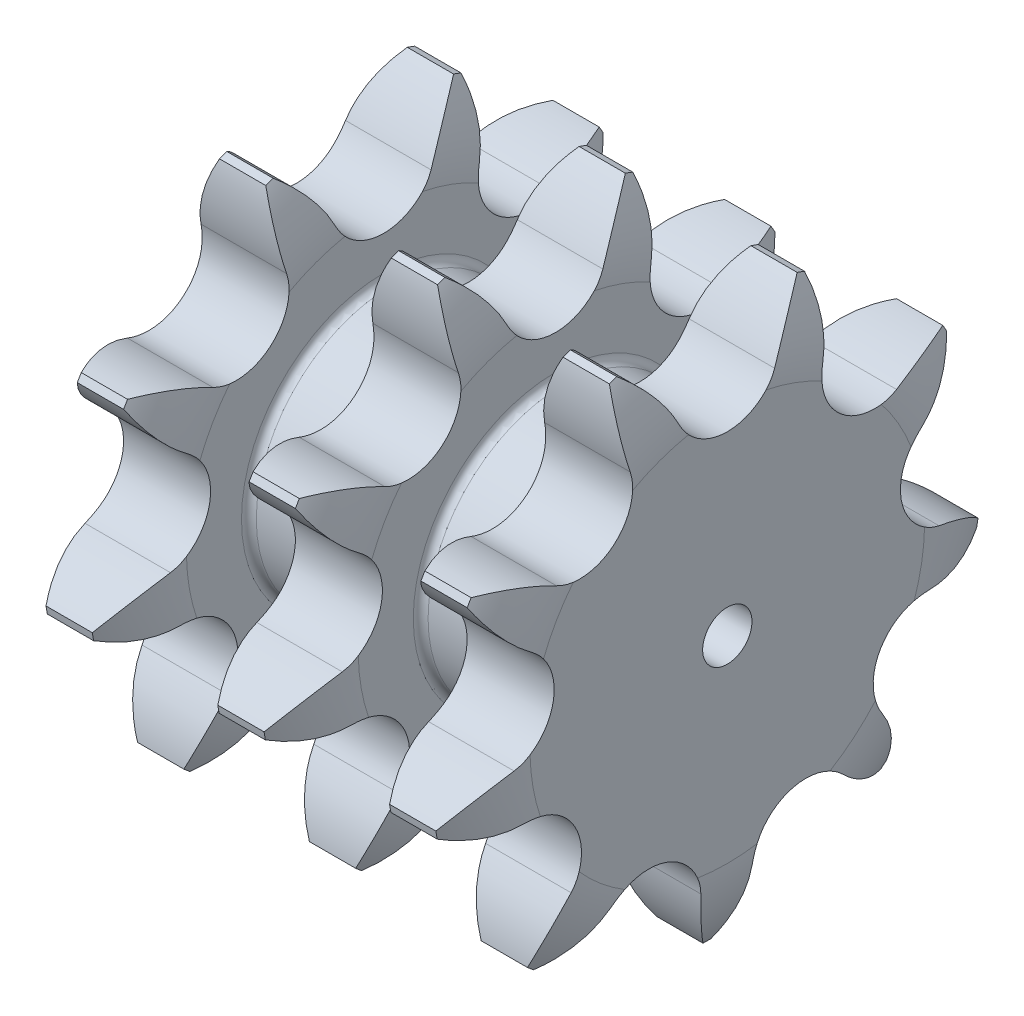
from build123d import *

# Parameters (mm, degrees)
GROOVES_COUNT   = 2
GROOVES_PITCH   = 13.92
TOOTHCUT_DEPTH  = 47.983955968
TEETHCUTS_COUNT = 9
TEETHCUTS_ANGLE = 320
BORSKE_R        = 2
BORE_DEPTH      = 50.0005


with BuildPart() as part:
    # BasProSke → Base-Revolve (revolve)
    with BuildSketch(Plane(origin=(0, 0, 0), x_dir=(1, 0, 0), z_dir=(0, 1, 0)), mode=Mode.PRIVATE) as base_revolve_sk:
        with BuildLine():
            Line((0, 0), (0, 15.986901099))
            ThreePointArc((0, 15.986901099), (0.41968445, 19.22477849), (1.651, 22.248657961))
            Line((1.651, 22.248657961), (33.2415, 22.248657961))
            ThreePointArc((33.2415, 22.248657961), (34.47281555, 19.22477849), (34.8925, 15.986901099))
            Line((34.8925, 15.986901099), (34.8925, 0))
            Line((34.8925, 0), (0, 0))
        make_face()
    revolve(base_revolve_sk.sketch.rotate(Axis((-10, 0, 0), (1, 0, 0)), 180), axis=Axis((-10, 0, 0), (1, 0, 0)))

    # GrvSke → Groove (revolve, cut)
    with BuildSketch(Plane(origin=(0, 0, 0), x_dir=(1, 0, 0), z_dir=(0, 1, 0)), mode=Mode.PRIVATE) as groove_sk:
        with BuildLine():
            Line((7.0525, 15.986901099), (7.0525, 11.525281635))
            ThreePointArc((7.0525, 11.525281635), (7.228235931, 11.101017566), (7.6525, 10.925281635))
            Line((7.6525, 10.925281635), (13.32, 10.925281635))
            ThreePointArc((13.32, 10.925281635), (13.744264069, 11.101017566), (13.92, 11.525281635))
            Line((13.92, 11.525281635), (13.92, 15.986901099))
            ThreePointArc((13.92, 15.986901099), (14.33968445, 19.22477849), (15.571, 22.248657961))
            Line((15.571, 22.248657961), (5.4015, 22.248657961))
            ThreePointArc((5.4015, 22.248657961), (6.63281555, 19.22477849), (7.0525, 15.986901099))
        make_face()
    groove = revolve(groove_sk.sketch.rotate(Axis((0, 0, 0), (1, 0, 0)), 180), axis=Axis((0, 0, 0), (1, 0, 0)), mode=Mode.SUBTRACT)

    # Grooves: Groove ×2
    with Locations(*[(i * GROOVES_PITCH, 0, 0) for i in range(1, GROOVES_COUNT)]):
        add(groove, mode=Mode.SUBTRACT)

    # TooCutSke → ToothCut (cut, through all)
    with BuildSketch(Plane(origin=(0, 0, 0), x_dir=(0, 0, -1), z_dir=(1, 0, 0))):
        with BuildLine():
            ThreePointArc((3.89490303, 16.792484851), (5.53909395, 19.346647696), (7.807509589, 21.366895728))
            ThreePointArc((7.807509589, 21.366895728), (0, 22.748657961), (-7.807509589, 21.366895728))
            ThreePointArc((-7.807509589, 21.366895728), (-5.53909395, 19.346647696), (-3.89490303, 16.792484851))
            ThreePointArc((-3.89490303, 16.792484851), (0, 14.311157961), (3.89490303, 16.792484851))
        make_face()
    toothcut = extrude(amount=TOOTHCUT_DEPTH, mode=Mode.SUBTRACT)

    # TeethCuts: ToothCut ×9 about axis
    teethcuts_axis = Axis((-10, 0, 0), (1, 0, 0))
    for i in range(1, TEETHCUTS_COUNT):
        add(toothcut.rotate(teethcuts_axis, i * TEETHCUTS_ANGLE / (TEETHCUTS_COUNT - 1)), mode=Mode.SUBTRACT)

    # BorSke → Bore (cut, symmetric)
    with BuildSketch(Plane(origin=(0, 0, 0), x_dir=(0, 0, -1), z_dir=(1, 0, 0))):
        with Locations(Location((0, 0, 0), (0, 0, 180))):
            Circle(BORSKE_R)
    extrude(amount=BORE_DEPTH, both=True, mode=Mode.SUBTRACT)


solid = part.part
